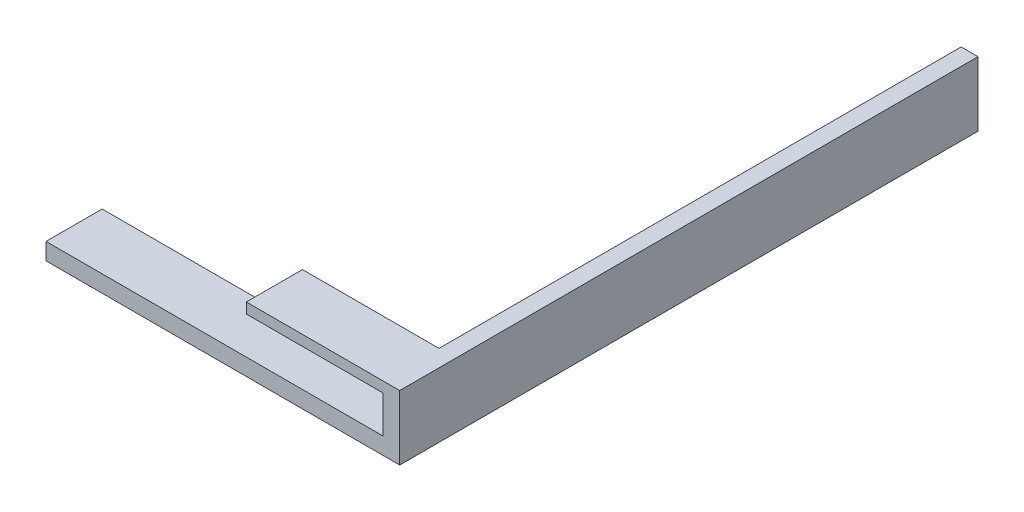
from build123d import *

# Parameters (mm, degrees)
SKETCH_1_W          = 63
SKETCH_1_H          = 10
EXTRUDE_1_DEPTH     = 2
SKETCH_4_W          = 2
SKETCH_4_H          = 10
EXTRUDE_2_DEPTH     = 93
SKETCH_5_W          = 61
SKETCH_5_H          = 10
EXTRUDE_3_DEPTH     = 1
SKETCH_6_W          = 10
SKETCH_6_H          = 92
EXTRUDE_4_DEPTH     = 1
SKETCH_7_W          = 3
SKETCH_7_H          = 10
EXTRUDE_5_DEPTH     = 93
SKETCH_10_W         = 26.594312394
SKETCH_10_H         = 101.559656513
CUT_EXTRUDE_1_DEPTH = 93
SKETCH_11_W         = 3
SKETCH_11_H         = 103
EXTRUDE_6_DEPTH     = 1.5
SKETCH_12_W         = 10
SKETCH_12_H         = 3.861283188
EXTRUDE_7_DEPTH     = 20.32
SKETCH_13_W         = 10
SKETCH_13_H         = 3.861283188
EXTRUDE_8_DEPTH     = 4
SKETCH_14_W         = 24.32
SKETCH_14_H         = 10
CUT_EXTRUDE_2_DEPTH = 2


with BuildPart() as part:
    # 草图1 → 凸台-拉伸1 (new body)
    with BuildSketch(Plane(origin=(0, 0, 0), x_dir=(1, 0, 0), z_dir=(0, 1, 0))):
        Rectangle(SKETCH_1_W, SKETCH_1_H)
    extrude(amount=EXTRUDE_1_DEPTH)

    # 草图4 → 凸台-拉伸2 (add)
    with BuildSketch(Plane(origin=(0, 2, 0), x_dir=(1, 0, 0), z_dir=(0, 1, 0))):
        with Locations((30.5, 0)):
            Rectangle(SKETCH_4_W, SKETCH_4_H)
    extrude(amount=EXTRUDE_2_DEPTH)

    # 草图5 → 凸台-拉伸3 (add)
    with BuildSketch(Plane(origin=(0, 2, 0), x_dir=(1, 0, 0), z_dir=(0, 1, 0))):
        with Locations((-1, 0)):
            Rectangle(SKETCH_5_W, SKETCH_5_H)
    extrude(amount=EXTRUDE_3_DEPTH)

    # 草图6 → 凸台-拉伸4 (add)
    with BuildSketch(Plane.ZY.offset(-29.5)):
        with Locations((0, 49)):
            Rectangle(SKETCH_6_W, SKETCH_6_H)
    extrude(amount=EXTRUDE_4_DEPTH)

    # 草图7 → 凸台-拉伸5 (add)
    with BuildSketch(Plane(origin=(0, 0, -5), x_dir=(-1, 0, 0), z_dir=(0, 0, -1))):
        with Locations((-30, 5)):
            Rectangle(SKETCH_7_W, SKETCH_7_H)
    extrude(amount=EXTRUDE_5_DEPTH)

    # 草图10 → 切除-拉伸1 (cut)
    with BuildSketch(Plane.ZY.offset(-28.5)):
        with Locations((8.297156197, 60.779828257)):
            Rectangle(SKETCH_10_W, SKETCH_10_H)
    extrude(amount=-CUT_EXTRUDE_1_DEPTH, mode=Mode.SUBTRACT)

    # 草图11 → 凸台-拉伸6 (add)
    with BuildSketch(Plane(origin=(0, 10, 0), x_dir=(1, 0, 0), z_dir=(0, 1, 0))):
        with Locations((30, 46.5)):
            Rectangle(SKETCH_11_W, SKETCH_11_H)
    extrude(amount=EXTRUDE_6_DEPTH)

    # 草图12 → 凸台-拉伸7 (add)
    with BuildSketch(Plane.ZY.offset(-28.5)):
        with Locations((0, 9.569358406)):
            Rectangle(SKETCH_12_W, SKETCH_12_H)
    extrude(amount=EXTRUDE_7_DEPTH)

    # 草图13 → 凸台-拉伸8 (add)
    with BuildSketch(Plane.ZY.offset(-8.18)):
        with Locations((0, 9.569358406)):
            Rectangle(SKETCH_13_W, SKETCH_13_H)
    extrude(amount=EXTRUDE_8_DEPTH)

    # 草图14 → 切除-拉伸2 (cut)
    with BuildSketch(Plane.XZ.offset(-7.638716812)):
        with Locations((16.34, 0)):
            Rectangle(SKETCH_14_W, SKETCH_14_H)
    extrude(amount=-CUT_EXTRUDE_2_DEPTH, mode=Mode.SUBTRACT)


solid = part.part
